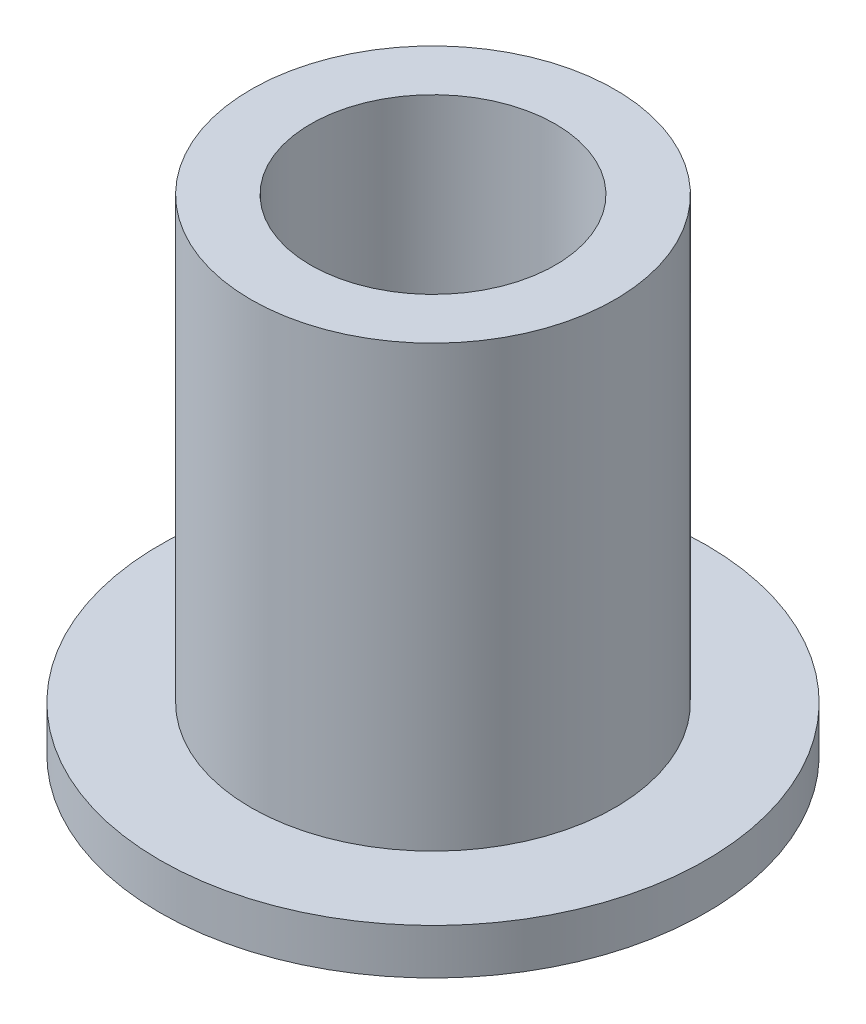
from build123d import *

# Parameters (mm, degrees)
SKETCH2_R           = 4.7625
SKETCH2_R_2         = 3.2004
BOSS_EXTRUDE1_DEPTH = 12.7
SKETCH3_R           = 7.14375
SKETCH3_R_2         = 4.7625
BOSS_EXTRUDE2_DEPTH = 1.190625


with BuildPart() as part:
    # Sketch2 → Boss-Extrude1 (new body)
    with BuildSketch(Plane(origin=(0, 0, 0), x_dir=(1, 0, 0), z_dir=(0, 1, 0))):
        with Locations(Location((0, 0, 0), (0, 0, 270))):
            Circle(SKETCH2_R)
        with Locations(Location((0, 0, 0), (0, 0, 270))):
            Circle(SKETCH2_R_2, mode=Mode.SUBTRACT)
    extrude(amount=BOSS_EXTRUDE1_DEPTH)

    # Sketch3 → Boss-Extrude2 (add)
    with BuildSketch(Plane(origin=(0, 0, 0), x_dir=(1, 0, 0), z_dir=(0, 1, 0))):
        with Locations(Location((0, 0, 0), (0, 0, 90))):
            Circle(SKETCH3_R)
        with Locations(Location((0, 0, 0), (0, 0, 270))):
            Circle(SKETCH3_R_2, mode=Mode.SUBTRACT)
    extrude(amount=BOSS_EXTRUDE2_DEPTH)


solid = part.part
